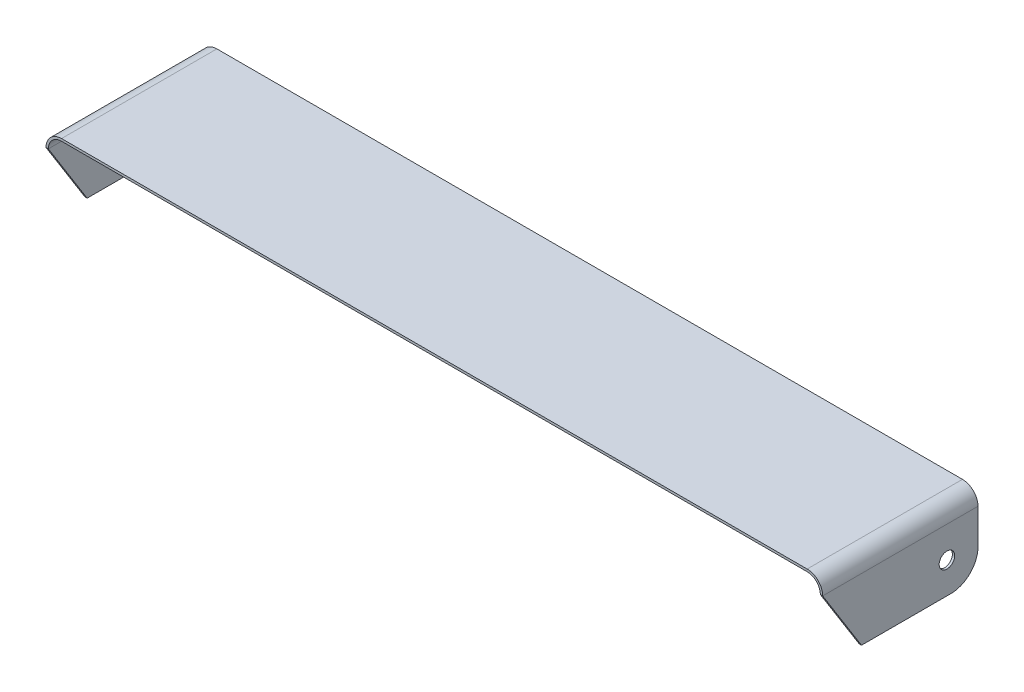
from build123d import *

# Parameters (mm, degrees)
DODANIE_WYCI_GNI_CIE1_DEPTH = 100
WYTNIJ_WYCI_GNI_CIE1_DEPTH  = 1010.950493836
SZKIC3_R                    = 10
WYTNIJ_WYCI_GNI_CIE2_DEPTH  = 1010.950493836
ZAOKR_GLENIE1_R             = 35


with BuildPart() as part:
    # Szkic1 → Dodanie-wyciągnięcie1 (new, symmetric)
    with BuildSketch(Plane.XY):
        with BuildLine():
            Line((-500, 0), (-500, 80))
            ThreePointArc((-500, 80), (-494.142135624, 94.142135624), (-480, 100))
            Line((-480, 100), (480, 100))
            ThreePointArc((480, 100), (494.142135624, 94.142135624), (500, 80))
            Line((500, 80), (500, 0))
            Line((500, 0), (497, 0))
            Line((497, 0), (497, 80))
            ThreePointArc((497, 80), (492.02081528, 92.02081528), (480, 97))
            Line((480, 97), (-480, 97))
            ThreePointArc((-480, 97), (-492.02081528, 92.02081528), (-497, 80))
            Line((-497, 80), (-497, 0))
            Line((-497, 0), (-500, 0))
        make_face()
    extrude(amount=DODANIE_WYCI_GNI_CIE1_DEPTH, both=True)

    # Szkic2 → Wytnij-wyciągnięcie1 (cut, through all)
    with BuildSketch(Plane(origin=(500, 0, 0), x_dir=(0, 0, -1), z_dir=(1, 0, 0))):
        Polygon((-100, 80), (-100, 0), (-50, 0), align=None)
    extrude(amount=-WYTNIJ_WYCI_GNI_CIE1_DEPTH, mode=Mode.SUBTRACT)

    # Szkic3 → Wytnij-wyciągnięcie2 (cut, through all)
    with BuildSketch(Plane.ZY.offset(500)):
        with Locations((-60, 40)):
            Circle(SZKIC3_R)
    extrude(amount=-WYTNIJ_WYCI_GNI_CIE2_DEPTH, mode=Mode.SUBTRACT)

    # Zaokrąglenie1
    zaokr_glenie1_edges = [part.edges().sort_by_distance(p)[0] for p in [
        (498.5, 0, -100),
        (-498.5, 0, -100),
    ]]
    fillet(zaokr_glenie1_edges, radius=ZAOKR_GLENIE1_R)


solid = part.part
